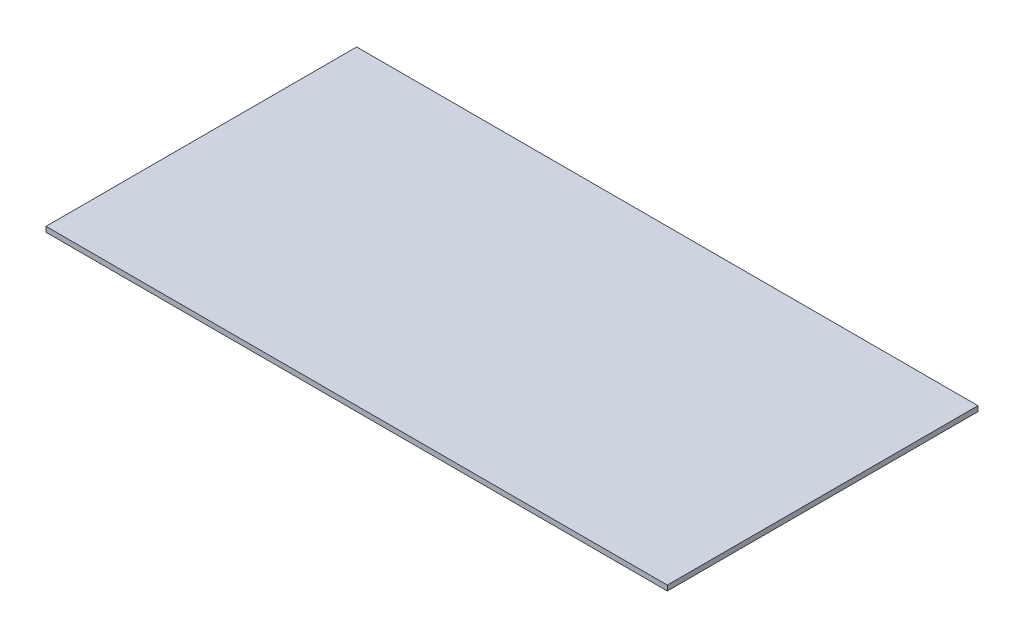
from build123d import *

# Parameters (mm, degrees)
SKETCH1_W           = 3000
SKETCH1_H           = 1500
BOSS_EXTRUDE1_DEPTH = 25


with BuildPart() as part:
    # Sketch1 → Boss-Extrude1 (new body)
    with BuildSketch(Plane(origin=(0, 0, 0), x_dir=(1, 0, 0), z_dir=(0, 1, 0))):
        Rectangle(SKETCH1_W, SKETCH1_H)
    extrude(amount=BOSS_EXTRUDE1_DEPTH)


solid = part.part
